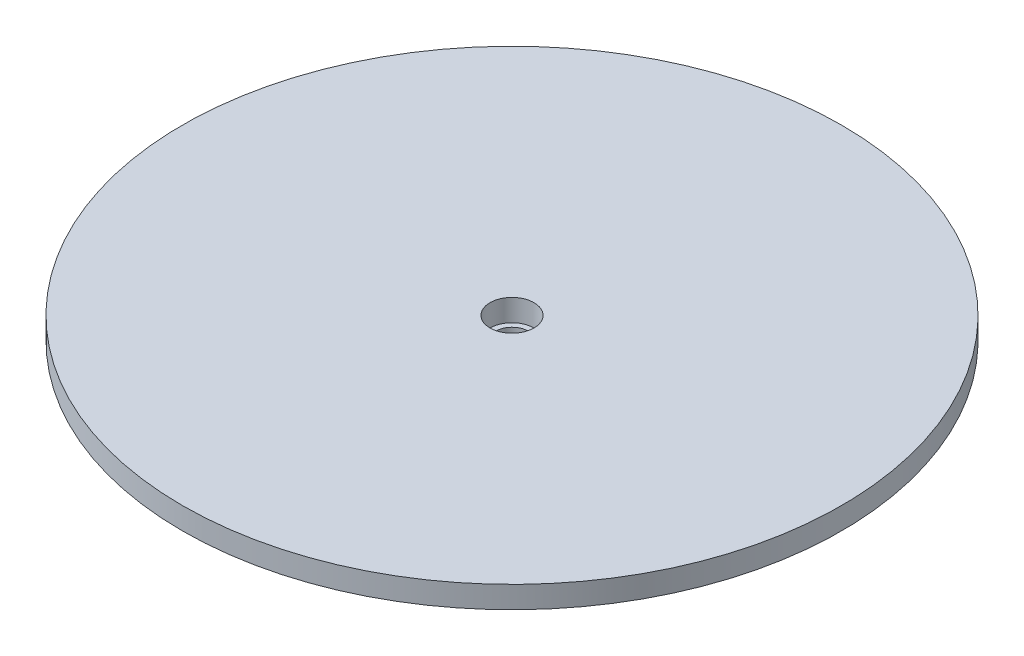
from build123d import *

# Parameters (mm, degrees)
SKETCH_1_R               = 30
EXTRUDE_1_DEPTH          = 2
SKETCH_2_W               = 6
SKETCH_2_H               = 6
EXTRUDE_2_DEPTH          = 2
CUT_EXTRUDE_1_DEPTH      = 43.473521163
CUT_EXTRUDE_1_DEPTH_BACK = 43.473521163
SKETCH_1_10_R            = 1.5
CUT_EXTRUDE_START        = 2
SKETCH_1_11_R            = 2
CUT_EXTRUDE_2_DEPTH      = 2


with BuildPart() as part:
    # 草图1 → 凸台-拉伸1 (new body)
    with BuildSketch(Plane(origin=(0, 0, 0), x_dir=(1, 0, 0), z_dir=(0, 1, 0))):
        with Locations(Location((0, 0, 0), (0, 0, 270))):
            Circle(SKETCH_1_R)
    extrude(amount=EXTRUDE_1_DEPTH)

    # 草图2 → 凸台-拉伸2 (add)
    with BuildSketch(Plane.XZ):
        Rectangle(SKETCH_2_W, SKETCH_2_H)
    extrude(amount=EXTRUDE_2_DEPTH)

    # 草图1<10> → 切除-拉伸1 (cut, two sides: drawn at the far end of the back side and taken through both)
    with BuildSketch(Plane(origin=(0, 0, 0), x_dir=(1, 0, 0), z_dir=(0, 1, 0)).offset(-CUT_EXTRUDE_1_DEPTH_BACK)):
        with Locations(Location((0, 0, 0), (0, 0, 270))):
            Circle(SKETCH_1_10_R)
    extrude(amount=CUT_EXTRUDE_1_DEPTH + CUT_EXTRUDE_1_DEPTH_BACK, mode=Mode.SUBTRACT)

    # 草图1<11> → 切除-拉伸2 (cut)
    with BuildSketch(Plane(origin=(0, 0, 0), x_dir=(1, 0, 0), z_dir=(0, 1, 0)).offset(CUT_EXTRUDE_START)):
        with Locations(Location((0, 0, 0), (0, 0, 270))):
            Circle(SKETCH_1_11_R)
    extrude(amount=-CUT_EXTRUDE_2_DEPTH, mode=Mode.SUBTRACT)


solid = part.part
